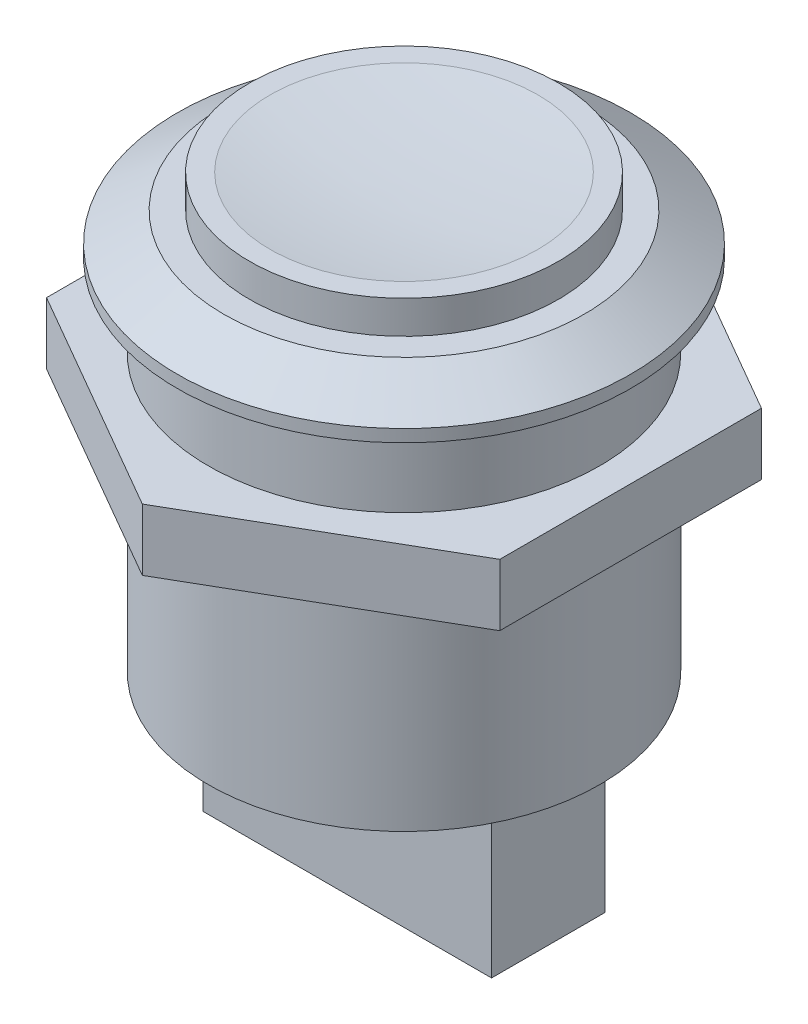
from build123d import *

# Parameters (mm, degrees)
SKETCH2_W           = 14
SKETCH2_H           = 5.5
BOSS_EXTRUDE1_DEPTH = 8
BOSS_EXTRUDE2_START = 4
BOSS_EXTRUDE2_DEPTH = 3


with BuildPart() as part:
    # Sketch1 → Revolve1 (revolve)
    with BuildSketch(Plane.XY, mode=Mode.PRIVATE) as revolve1_sk:
        with BuildLine():
            Line((9.5, 0), (11, 0))
            Line((11, 0), (11, 0.6))
            Line((11, 0.6), (8.75, 2))
            Line((8.75, 2), (7.5, 2))
            Line((7.5, 2), (7.5, 3.6))
            Line((7.5, 3.6), (6.5, 3.6))
            ThreePointArc((6.5, 3.6), (3.259601203, 3.225184366), (0, 3.1))
            Line((0, 3.1), (0, -17.4))
            Line((0, -17.4), (9.5, -17.4))
            Line((9.5, -17.4), (9.5, 0))
        make_face()
    revolve(revolve1_sk.sketch.rotate(Axis((0, 3.6, 0), (0, 1, 0)), 90), axis=Axis((0, 3.6, 0), (0, 1, 0)))

    # Sketch2 → Boss-Extrude1 (add)
    with BuildSketch(Plane.XZ.offset(17.4)):
        Rectangle(SKETCH2_W, SKETCH2_H)
    extrude(amount=BOSS_EXTRUDE1_DEPTH)

    # Sketch3 → Boss-Extrude2 (add)
    with BuildSketch(Plane.XZ.offset(BOSS_EXTRUDE2_START)):
        Polygon((0, 12.701705922), (-11, 6.350852961), (-11, -6.350852961), (0, -12.701705922), (11, -6.350852961), (11, 6.350852961), align=None)
    extrude(amount=BOSS_EXTRUDE2_DEPTH)


solid = part.part
